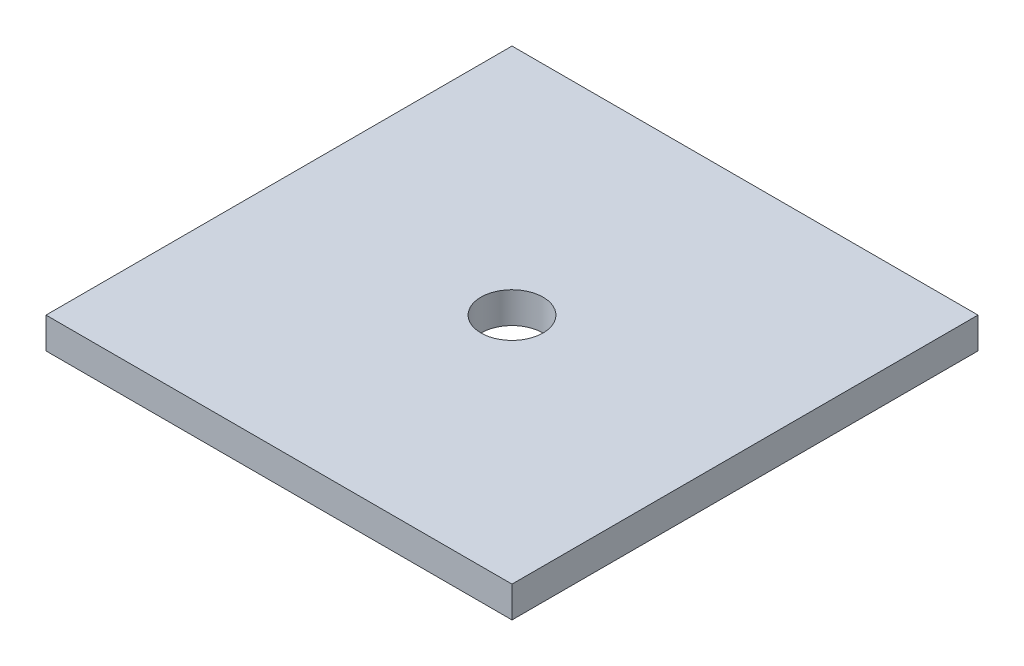
from build123d import *

# Parameters (mm, degrees)
SKETCH_1_W      = 60
SKETCH_1_H      = 60
SKETCH_1_R      = 4
EXTRUDE_1_DEPTH = 4


with BuildPart() as part:
    # 草图1 → 凸台-拉伸1 (new body)
    with BuildSketch(Plane(origin=(0, 0, 0), x_dir=(1, 0, 0), z_dir=(0, 1, 0))):
        Rectangle(SKETCH_1_W, SKETCH_1_H)
        with Locations(Location((0, 0, 0), (0, 0, 270))):
            Circle(SKETCH_1_R, mode=Mode.SUBTRACT)
    extrude(amount=EXTRUDE_1_DEPTH)


solid = part.part
